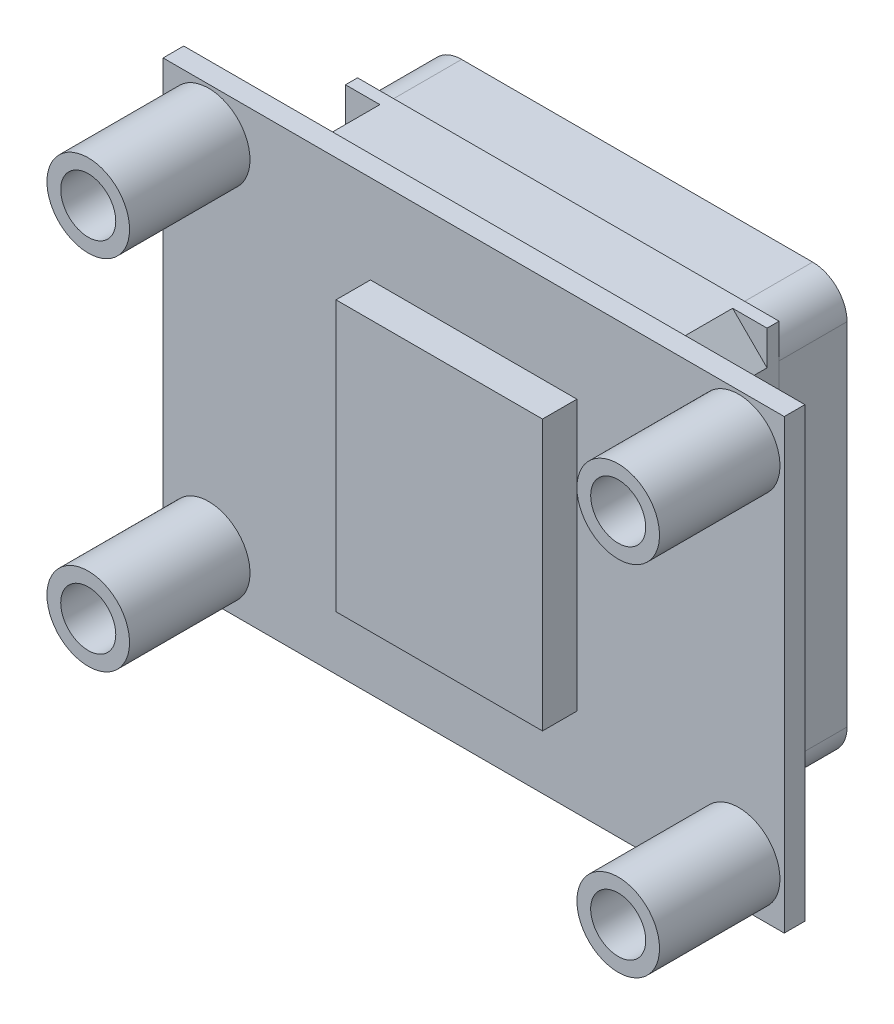
from build123d import *

# Parameters (mm, degrees)
SKETCH1_W           = 36.1
SKETCH1_H           = 26
SKETCH1_R           = 1.6
BOSS_EXTRUDE1_DEPTH = 1.2
BOSS_EXTRUDE2_DEPTH = 3.5
SKETCH3_W           = 24.5
SKETCH3_H           = 24.5
BOSS_EXTRUDE3_DEPTH = 0.7
BOSS_EXTRUDE5_DEPTH = 4
BOSS_EXTRUDE6_DEPTH = 0.1
SKETCH6_R           = 0.907363589
BOSS_EXTRUDE7_DEPTH = 0.5
SKETCH7_W           = 12
SKETCH7_H           = 15.7
BOSS_EXTRUDE8_DEPTH = 2
SKETCH8_R           = 2.4
BOSS_EXTRUDE9_DEPTH = 7
SKETCH9_R           = 1.6
CUT_EXTRUDE3_DEPTH  = 28.996472992


with BuildPart() as part:
    # Sketch1 → Boss-Extrude1 (new body)
    with BuildSketch(Plane.XY):
        Rectangle(SKETCH1_W, SKETCH1_H)
        with Locations((-15.4, 10.4)):
            Circle(SKETCH1_R, mode=Mode.SUBTRACT)
        with Locations(Location((15.4, 10.4, 0), (0, 0, 180))):
            Circle(SKETCH1_R, mode=Mode.SUBTRACT)
        with Locations((15.4, -10.4)):
            Circle(SKETCH1_R, mode=Mode.SUBTRACT)
        with Locations(Location((-15.4, -10.4, 0), (0, 0, 180))):
            Circle(SKETCH1_R, mode=Mode.SUBTRACT)
    extrude(amount=BOSS_EXTRUDE1_DEPTH)

    # Sketch2 → Boss-Extrude2 (add)
    with BuildSketch(Plane(origin=(0, 0, 0), x_dir=(-1, 0, 0), z_dir=(0, 0, -1))):
        Polygon((-10.35, 12.25), (-12.35, 10.25), (-12.35, -10.25), (-10.35, -12.25), (10.15, -12.25), (12.15, -10.25), (12.15, 10.25), (10.15, 12.25), align=None)
    extrude(amount=BOSS_EXTRUDE2_DEPTH)

    # Sketch3 → Boss-Extrude3 (add)
    with BuildSketch(Plane(origin=(0, 0, -3.5), x_dir=(-1, 0, 0), z_dir=(0, 0, -1))):
        with Locations((-0.1, 0)):
            Rectangle(SKETCH3_W, SKETCH3_H)
    extrude(amount=BOSS_EXTRUDE3_DEPTH)

    # Sketch4 → Boss-Extrude5 (add)
    with BuildSketch(Plane(origin=(0, 0, -4.2), x_dir=(-1, 0, 0), z_dir=(0, 0, -1))):
        with BuildLine():
            Line((10.1, -12.2), (-10.3, -12.2))
            ThreePointArc((-10.3, -12.2), (-11.714213562, -11.614213562), (-12.3, -10.2))
            Line((-12.3, -10.2), (-12.3, 10.2))
            ThreePointArc((-12.3, 10.2), (-11.714213562, 11.614213562), (-10.3, 12.2))
            Line((-10.3, 12.2), (10.1, 12.2))
            ThreePointArc((10.1, 12.2), (11.514213562, 11.614213562), (12.1, 10.2))
            Line((12.1, 10.2), (12.1, -10.2))
            ThreePointArc((12.1, -10.2), (11.514213562, -11.614213562), (10.1, -12.2))
        make_face()
    extrude(amount=BOSS_EXTRUDE5_DEPTH)

    # Sketch5 → Boss-Extrude6 (add)
    with BuildSketch(Plane(origin=(0, 0, -8.2), x_dir=(-1, 0, 0), z_dir=(0, 0, -1))):
        with BuildLine():
            Line((9.5, -11.5), (-9.5, -11.5))
            ThreePointArc((-9.5, -11.5), (-10.914213562, -10.914213562), (-11.5, -9.5))
            Line((-11.5, -9.5), (-11.5, 9.5))
            ThreePointArc((-11.5, 9.5), (-10.914213562, 10.914213562), (-9.5, 11.5))
            Line((-9.5, 11.5), (9.5, 11.5))
            ThreePointArc((9.5, 11.5), (10.914213562, 10.914213562), (11.5, 9.5))
            Line((11.5, 9.5), (11.5, -9.5))
            ThreePointArc((11.5, -9.5), (10.914213562, -10.914213562), (9.5, -11.5))
        make_face()
    extrude(amount=BOSS_EXTRUDE6_DEPTH)

    # Sketch6 → Boss-Extrude7 (add)
    with BuildSketch(Plane(origin=(0, 0, -8.3), x_dir=(-1, 0, 0), z_dir=(0, 0, -1))):
        with Locations((1, 0)):
            Circle(SKETCH6_R)
    extrude(amount=BOSS_EXTRUDE7_DEPTH)

    # Sketch7 → Boss-Extrude8 (add)
    with BuildSketch(Plane.XY.offset(1.2)):
        Rectangle(SKETCH7_W, SKETCH7_H)
    extrude(amount=BOSS_EXTRUDE8_DEPTH)

    # Sketch8 → Boss-Extrude9 (add)
    with BuildSketch(Plane.XY.offset(1.2)):
        with Locations((-15.4, 10.4)):
            Circle(SKETCH8_R)
        with Locations(Location((15.4, 10.4, 0), (0, 0, 180))):
            Circle(SKETCH8_R)
        with Locations((15.4, -10.4)):
            Circle(SKETCH8_R)
        with Locations(Location((-15.4, -10.4, 0), (0, 0, 180))):
            Circle(SKETCH8_R)
    extrude(amount=BOSS_EXTRUDE9_DEPTH)

    # Sketch9 → Cut-Extrude3 (cut, through all)
    with BuildSketch(Plane.XY.offset(8.2)):
        with Locations((-15.4, 10.4)):
            Circle(SKETCH9_R)
        with Locations(Location((-15.4, -10.4, 0), (0, 0, 180))):
            Circle(SKETCH9_R)
        with Locations((15.4, -10.4)):
            Circle(SKETCH9_R)
        with Locations(Location((15.4, 10.4, 0), (0, 0, 180))):
            Circle(SKETCH9_R)
    extrude(amount=-CUT_EXTRUDE3_DEPTH, mode=Mode.SUBTRACT)


solid = part.part
